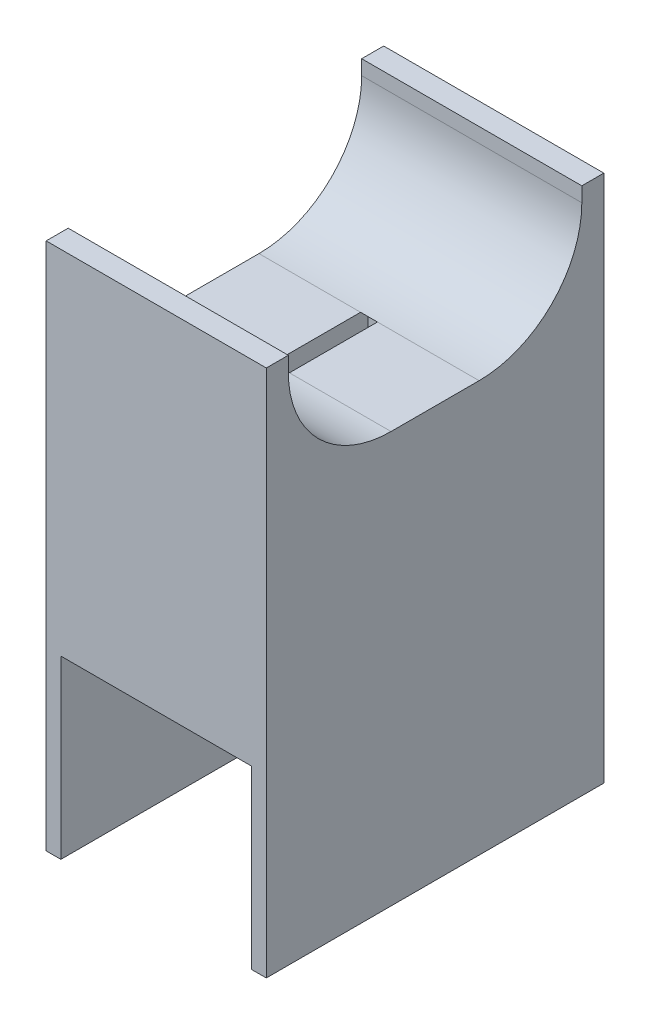
from build123d import *

# Parameters (mm, degrees)
SKETCH1_W           = 15
SKETCH1_H           = 23
BOSS_EXTRUDE1_DEPTH = 26
SKETCH4_W           = 20
SKETCH4_H           = 8
CUT_EXTRUDE2_DEPTH  = 33.144206321
FILLET1_R           = 7
SKETCH5_W           = 15
SKETCH5_H           = 23
BOSS_EXTRUDE2_DEPTH = 10
SKETCH7_W           = 13
SKETCH7_H           = 12
CUT_EXTRUDE3_DEPTH  = 36.514081714
SKETCH11_W          = 1.15
SKETCH11_H          = 7
CUT_EXTRUDE4_DEPTH  = 16


with BuildPart() as part:
    # Sketch1 → Boss-Extrude1 (new body)
    with BuildSketch(Plane(origin=(0, 0, 0), x_dir=(1, 0, 0), z_dir=(0, 1, 0))):
        Rectangle(SKETCH1_W, SKETCH1_H)
    extrude(amount=BOSS_EXTRUDE1_DEPTH)

    # Sketch4 → Cut-Extrude2 (cut, through all)
    with BuildSketch(Plane(origin=(7.5, 0, 0), x_dir=(0, 0, -1), z_dir=(1, 0, 0))):
        with Locations((0, 22)):
            Rectangle(SKETCH4_W, SKETCH4_H)
    extrude(amount=-CUT_EXTRUDE2_DEPTH, mode=Mode.SUBTRACT)

    # Fillet1
    fillet1_edges = [part.edges().sort_by_distance(p)[0] for p in [
        (0, 18, 10),
        (0, 18, -10),
    ]]
    fillet(fillet1_edges, radius=FILLET1_R)

    # Sketch5 → Boss-Extrude2 (add)
    with BuildSketch(Plane.XZ):
        Rectangle(SKETCH5_W, SKETCH5_H)
    extrude(amount=BOSS_EXTRUDE2_DEPTH)

    # Sketch7 → Cut-Extrude3 (cut, through all)
    with BuildSketch(Plane.XY.offset(11.5)):
        with Locations((0, -4)):
            Rectangle(SKETCH7_W, SKETCH7_H)
    extrude(amount=-CUT_EXTRUDE3_DEPTH, mode=Mode.SUBTRACT)

    # Sketch11 → Cut-Extrude4 (cut)
    with BuildSketch(Plane.XZ.offset(-2)):
        Rectangle(SKETCH11_W, SKETCH11_H)
    extrude(amount=-CUT_EXTRUDE4_DEPTH, mode=Mode.SUBTRACT)


solid = part.part
